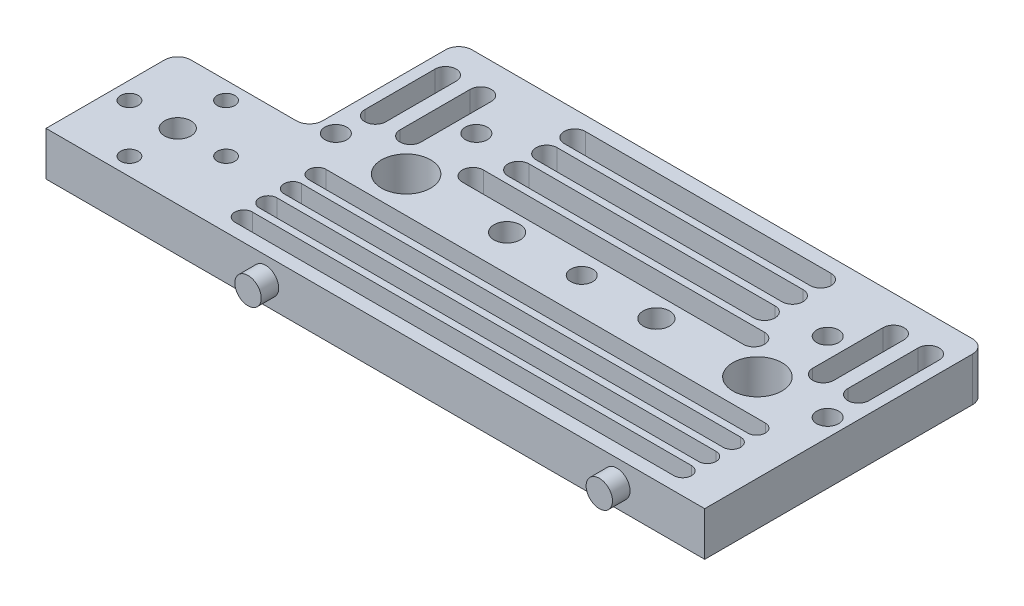
from build123d import *

# Parameters (mm, degrees)
SKETCH_1_W          = 15
SKETCH_1_H          = 15
EXTRUDE_1_DEPTH     = 5
SKETCH_2_R          = 1.5
SKETCH_2_R_2        = 1.25
SKETCH_2_R_3        = 2.8
SKETCH_2_R_4        = 1
CUT_EXTRUDE_1_DEPTH = 5
FILLET_1_R          = 1.5
SKETCH_4_R          = 1.5
EXTRUDE_2_DEPTH     = 2
SKETCH_5_R          = 2
CUT_EXTRUDE_2_DEPTH = 5
CUT_EXTRUDE_3_DEPTH = 5


with BuildPart() as part:
    # 草图1 → 凸台-拉伸1 (new body)
    with BuildSketch(Plane(origin=(0, 0, 0), x_dir=(1, 0, 0), z_dir=(0, 1, 0))):
        Polygon((30, 16), (-30, 16), (-30, -1), (-30, -16), (30, -16), align=None)
        with Locations((-37.5, -8.5)):
            Rectangle(SKETCH_1_W, SKETCH_1_H)
    extrude(amount=EXTRUDE_1_DEPTH)

    # 草图2 → 切除-拉伸1 (cut)
    with BuildSketch(Plane(origin=(0, 5, 0), x_dir=(1, 0, 0), z_dir=(0, 1, 0))):
        with Locations(Location((8.5, 0, 0), (0, 0, 270))):
            Circle(SKETCH_2_R)
        with Locations(Location((-8.5, 0, 0), (0, 0, 90))):
            Circle(SKETCH_2_R)
        with Locations(Location((0, 0, 0), (0, 0, 270))):
            Circle(SKETCH_2_R_2)
        with Locations(Location((20, 0, 0), (0, 0, 270))):
            Circle(SKETCH_2_R_3)
        with Locations(Location((-20, 0, 0), (0, 0, 90))):
            Circle(SKETCH_2_R_3)
        with Locations(Location((20, 8, 0), (0, 0, 270))):
            Circle(SKETCH_2_R_2)
        with Locations(Location((28, 0, 0), (0, 0, 270))):
            Circle(SKETCH_2_R_2)
        with Locations(Location((-28, 0, 0), (0, 0, 90))):
            Circle(SKETCH_2_R_2)
        with Locations(Location((-20, 8, 0), (0, 0, 90))):
            Circle(SKETCH_2_R_2)
        with Locations(Location((-37.5, -8.5, 0), (0, 0, 270))):
            Circle(SKETCH_2_R)
        with Locations(Location((-32, -8.5, 0), (0, 0, 270))):
            Circle(SKETCH_2_R_4)
        with Locations(Location((-37.5, -14, 0), (0, 0, 270))):
            Circle(SKETCH_2_R_4)
        with Locations(Location((-43, -8.5, 0), (0, 0, 270))):
            Circle(SKETCH_2_R_4)
        with Locations(Location((-37.5, -3, 0), (0, 0, 270))):
            Circle(SKETCH_2_R_4)
    extrude(amount=-CUT_EXTRUDE_1_DEPTH, mode=Mode.SUBTRACT)

    # 圆角1
    fillet_1_edges = [part.edges().sort_by_distance(p)[0] for p in [
        (-30, 2.5, 1),
        (-45, 2.5, 1),
        (-30, 2.5, -16),
        (30, 2.5, -16),
    ]]
    fillet(fillet_1_edges, radius=FILLET_1_R)

    # 草图4 → 凸台-拉伸2 (add)
    with BuildSketch(Plane.XY.offset(16)):
        with Locations(Location((20, 2.5, 0), (0, 0, 180))):
            Circle(SKETCH_4_R)
        with Locations(Location((-20, 2.5, 0), (0, 0, 180))):
            Circle(SKETCH_4_R)
    extrude(amount=EXTRUDE_2_DEPTH)

    # 草图5 → 切除-拉伸2 (cut)
    with BuildSketch(Plane(origin=(0, 0, -16), x_dir=(-1, 0, 0), z_dir=(0, 0, -1))):
        with Locations((-20, 2.5)):
            Circle(SKETCH_5_R)
        with Locations(Location((20, 2.5, 0), (0, 0, 180))):
            Circle(SKETCH_5_R)
    extrude(amount=-CUT_EXTRUDE_2_DEPTH, mode=Mode.SUBTRACT)

    # 草图6 → 切除-拉伸3 (cut)
    with BuildSketch(Plane.XZ):
        with BuildLine():
            Line((-25, 14.5), (25, 14.5))
            ThreePointArc((25, 14.5), (26, 13.5), (25, 12.5))
            Line((25, 12.5), (-25, 12.5))
            ThreePointArc((-25, 12.5), (-26, 13.5), (-25, 14.5))
        make_face()
        with BuildLine():
            Line((-25, 11.7), (25, 11.7))
            ThreePointArc((25, 11.7), (26, 10.7), (25, 9.7))
            Line((25, 9.7), (-25, 9.7))
            ThreePointArc((-25, 9.7), (-26, 10.7), (-25, 11.7))
        make_face()
        with BuildLine():
            Line((-25, 8.9), (25, 8.9))
            ThreePointArc((25, 8.9), (26, 7.9), (25, 6.9))
            Line((25, 6.9), (-25, 6.9))
            ThreePointArc((-25, 6.9), (-26, 7.9), (-25, 8.9))
        make_face()
        with BuildLine():
            Line((-25, 6.1), (25, 6.1))
            ThreePointArc((25, 6.1), (26, 5.1), (25, 4.1))
            Line((25, 4.1), (-25, 4.1))
            ThreePointArc((-25, 4.1), (-26, 5.1), (-25, 6.1))
        make_face()
        with BuildLine():
            Line((-16, -2.4), (16, -2.4))
            ThreePointArc((16, -2.4), (17.2, -3.6), (16, -4.8))
            Line((16, -4.8), (-16, -4.8))
            ThreePointArc((-16, -4.8), (-17.2, -3.6), (-16, -2.4))
        make_face()
        with BuildLine():
            Line((-14, -5.6), (14, -5.6))
            ThreePointArc((14, -5.6), (15.2, -6.8), (14, -8))
            Line((14, -8), (-14, -8))
            ThreePointArc((-14, -8), (-15.2, -6.8), (-14, -5.6))
        make_face()
        with BuildLine():
            Line((-14, -8.8), (14, -8.8))
            ThreePointArc((14, -8.8), (15.2, -10), (14, -11.2))
            Line((14, -11.2), (-14, -11.2))
            ThreePointArc((-14, -11.2), (-15.2, -10), (-14, -8.8))
        make_face()
        with BuildLine():
            Line((-14, -12), (14, -12))
            ThreePointArc((14, -12), (15.2, -13.2), (14, -14.4))
            Line((14, -14.4), (-14, -14.4))
            ThreePointArc((-14, -14.4), (-15.2, -13.2), (-14, -12))
        make_face()
        with BuildLine():
            Line((-22.3, -4), (-22.3, -12))
            ThreePointArc((-22.3, -12), (-23.5, -13.2), (-24.7, -12))
            Line((-24.7, -12), (-24.7, -4))
            ThreePointArc((-24.7, -4), (-23.5, -2.8), (-22.3, -4))
        make_face()
        with BuildLine():
            Line((-26.3, -4), (-26.3, -12))
            ThreePointArc((-26.3, -12), (-27.5, -13.2), (-28.7, -12))
            Line((-28.7, -12), (-28.7, -4))
            ThreePointArc((-28.7, -4), (-27.5, -2.8), (-26.3, -4))
        make_face()
        with BuildLine():
            Line((22.3, -4), (22.3, -12))
            ThreePointArc((22.3, -12), (23.5, -13.2), (24.7, -12))
            Line((24.7, -12), (24.7, -4))
            ThreePointArc((24.7, -4), (23.5, -2.8), (22.3, -4))
        make_face()
        with BuildLine():
            Line((26.3, -4), (26.3, -12))
            ThreePointArc((26.3, -12), (27.5, -13.2), (28.7, -12))
            Line((28.7, -12), (28.7, -4))
            ThreePointArc((28.7, -4), (27.5, -2.8), (26.3, -4))
        make_face()
    extrude(amount=-CUT_EXTRUDE_3_DEPTH, mode=Mode.SUBTRACT)


solid = part.part
